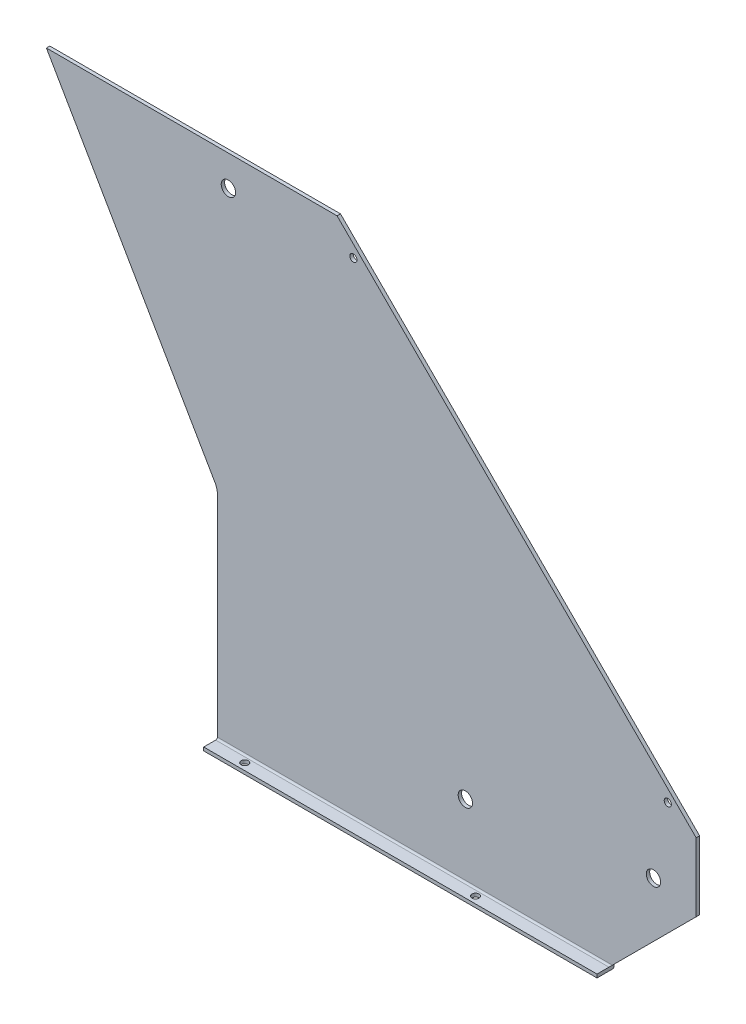
from build123d import *

# Parameters (mm, degrees)
BOSS_EXTRU_1_DEPTH      = 2
ESQUISSE2_W             = 230
ESQUISSE2_H             = 10
BOSS_EXTRU_2_DEPTH      = 2
CONG_1_R                = 1
ESQUISSE3_R             = 4.2
ENL_V_MAT_EXTRU_1_DEPTH = 285.197114693
ESQUISSE5_R             = 2.1
ENL_V_MAT_EXTRU_2_DEPTH = 385.317577012
ESQUISSE6_R             = 2.1
ENL_V_MAT_EXTRU_3_DEPTH = 285.197114693
CONG_2_R                = 10


with BuildPart() as part:
    # Esquisse1 → Boss.-Extru.1 (new body)
    with BuildSketch(Plane.XY):
        Polygon((140, -60), (-70, 150), (-140, 150), (-240, 150), (-140, -23.205080757), (-140, -150), (90, -150), (140, -100), align=None)
    extrude(amount=BOSS_EXTRU_1_DEPTH)

    # Esquisse2 → Boss.-Extru.2 (add)
    with BuildSketch(Plane.XZ.offset(150)):
        with Locations((-25, 5)):
            Rectangle(ESQUISSE2_W, ESQUISSE2_H)
    extrude(amount=BOSS_EXTRU_2_DEPTH)

    # Congé1
    cong_1_edges = [part.edges().sort_by_distance(p)[0] for p in [
        (-25, -152, 0),
        (-25, -150, 2),
    ]]
    fillet(cong_1_edges, radius=CONG_1_R)

    # Esquisse3 → Enlèv. mat.-Extru.1 (cut, through all)
    with BuildSketch(Plane.XY.offset(2)):
        with Locations((-133.564064606, 132.10753113)):
            Circle(ESQUISSE3_R)
        with Locations((5, -107.89246887)):
            Circle(ESQUISSE3_R)
        with Locations((115, -92.89246887)):
            Circle(ESQUISSE3_R)
    extrude(amount=-ENL_V_MAT_EXTRU_1_DEPTH, mode=Mode.SUBTRACT)

    # Esquisse5 → Enlèv. mat.-Extru.2 (cut, through all)
    with BuildSketch(Plane(origin=(0, -150, 0), x_dir=(1, 0, 0), z_dir=(0, 1, 0))):
        with Locations(Location((15, -6, 0), (0, 0, 270))):
            Circle(ESQUISSE5_R)
        with Locations(Location((-120, -6, 0), (0, 0, 270))):
            Circle(ESQUISSE5_R)
    extrude(amount=-ENL_V_MAT_EXTRU_2_DEPTH, mode=Mode.SUBTRACT)

    # Esquisse6 → Enlèv. mat.-Extru.3 (cut, through all)
    with BuildSketch(Plane.XY.offset(2)):
        with Locations((123.388347648, -50.45941546)):
            Circle(ESQUISSE6_R)
        with Locations((-60.45941546, 133.388347648)):
            Circle(ESQUISSE6_R)
    extrude(amount=-ENL_V_MAT_EXTRU_3_DEPTH, mode=Mode.SUBTRACT)

    # Congé2
    cong_2_edges = [part.edges().sort_by_distance(p)[0] for p in [
        (-140, -23.205080757, 1),
    ]]
    fillet(cong_2_edges, radius=CONG_2_R)


solid = part.part
